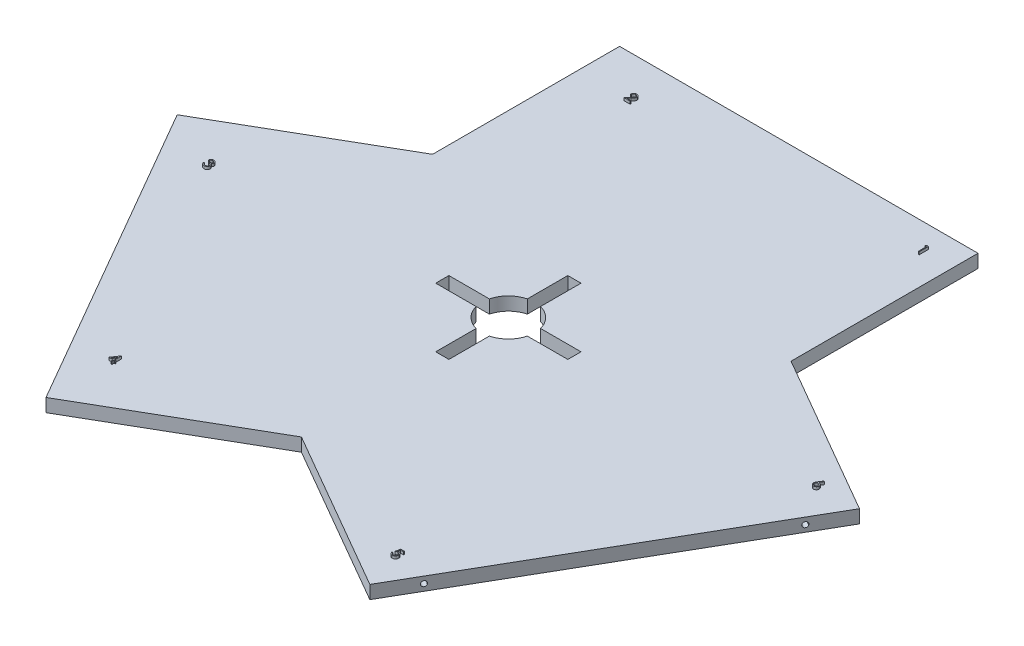
from build123d import *

# Parameters (mm, degrees)
BOSS_EXTRUDE1_DEPTH = 5
BOSS_EXTRUDE2_DEPTH = 1
SKETCH3_R           = 1
CUT_EXTRUDE1_DEPTH  = 10
CIRPATTERN1_COUNT   = 3


with BuildPart() as part:
    # Sketch1 → Boss-Extrude1 (new body)
    with BuildSketch(Plane(origin=(0, 0, 0), x_dir=(1, 0, 0), z_dir=(0, 1, 0))):
        Polygon((-67.827282718, 39.160099935), (-67.827282718, 109.92847338), (67.827282718, 109.92847338), (67.827282718, 39.160099935), (129.114491905, 3.775913213), (61.287209187, -113.704386593), (0, -78.320199871), (-61.287209187, -113.704386593), (-129.114491905, 3.775913213), align=None)
        with BuildLine():
            ThreePointArc((9.682458366, 2.5), (7.071067812, 7.071067812), (2.5, 9.682458366))
            Line((2.5, 9.682458366), (2.5, 25))
            Line((2.5, 25), (-2.5, 25))
            Line((-2.5, 25), (-2.5, 9.682458366))
            ThreePointArc((-2.5, 9.682458366), (-7.071067812, 7.071067812), (-9.682458366, 2.5))
            Line((-9.682458366, 2.5), (-25, 2.5))
            Line((-25, 2.5), (-25, -2.5))
            Line((-25, -2.5), (-9.682458366, -2.5))
            ThreePointArc((-9.682458366, -2.5), (-7.071067812, -7.071067812), (-2.5, -9.682458366))
            Line((-2.5, -9.682458366), (-2.5, -25))
            Line((-2.5, -25), (2.5, -25))
            Line((2.5, -25), (2.5, -9.682458366))
            ThreePointArc((2.5, -9.682458366), (7.071067812, -7.071067812), (9.682458366, -2.5))
            Line((9.682458366, -2.5), (25, -2.5))
            Line((25, -2.5), (25, 2.5))
            Line((25, 2.5), (9.682458366, 2.5))
        make_face(mode=Mode.SUBTRACT)
    extrude(amount=BOSS_EXTRUDE1_DEPTH)

    # Sketch2 → Boss-Extrude2 (add)
    # profile 1 of 6: a face of its own
    with BuildSketch(Plane(origin=(0, 5, 0), x_dir=(1, 0, 0), z_dir=(0, 1, 0))):
        Polygon((56.557223015, 101.794048137), (57.204358432, 101.794048137), (57.204358432, 98.294048137), (56.890255868, 98.294048137), (56.890255868, 101.435073778), (56.351794329, 101.435073778), align=None)
    # profile 2 of 6: a face of its own
    with BuildSketch(Plane(origin=(0, 5, 0), x_dir=(1, 0, 0), z_dir=(0, 1, 0))):
        with BuildLine():
            Line((-48.778901469, 95.373471968), (-49.093004033, 95.373471968))
            add(Edge.make_bspline(
                [(-49.093004033, 95.373471968), (-49.09095688, 95.415142856), (-49.086936326, 95.49698337), (-49.068108037, 95.616307276), (-49.04116716, 95.730362075), (-49.003075706, 95.838231989), (-48.955769428, 95.940870796), (-48.899039401, 96.037870812), (-48.83184555, 96.128862001), (-48.755638816, 96.213000844), (-48.672870177, 96.290188415), (-48.583564238, 96.356843658), (-48.48971921, 96.413161329), (-48.391619811, 96.460242571), (-48.288159248, 96.495582417), (-48.18027639, 96.521804056), (-48.067497254, 96.537580402), (-47.990657232, 96.539276188), (-47.951577751, 96.540138634)],
                knots=[0, 0, 0, 0, 1.10065271, 2.161652631, 3.183658789, 4.190468796, 5.17591951, 6.163126047, 7.15150782, 8.156236427, 9.156009102, 10.134482811, 11.092018607, 12.041330605, 13.001268258, 13.972401359, 14.968799086, 16, 16, 16, 16], degree=3))
            add(Edge.make_bspline(
                [(-47.951577751, 96.540138634), (-47.913199677, 96.539240178), (-47.837788133, 96.537474743), (-47.727726118, 96.522313714), (-47.622948824, 96.498568122), (-47.523661057, 96.465252706), (-47.430654993, 96.420468279), (-47.343231948, 96.36667074), (-47.260351137, 96.304450909), (-47.185744354, 96.231197095), (-47.117236274, 96.152994711), (-47.058134019, 96.069506807), (-47.007520856, 95.983277521), (-46.965333176, 95.89364932), (-46.934277037, 95.799778291), (-46.910698829, 95.703031088), (-46.897371415, 95.602406277), (-46.895325992, 95.534299722), (-46.894286085, 95.499673891)],
                knots=[0, 0, 0, 0, 1.111607364, 2.184268762, 3.212621178, 4.221274766, 5.211760367, 6.196651075, 7.1921475, 8.207485113, 9.220403448, 10.201281604, 11.166441695, 12.114753415, 13.065576456, 14.026450734, 14.996634279, 16, 16, 16, 16], degree=3))
            add(Edge.make_bspline(
                [(-46.894286085, 95.499673891), (-46.895979348, 95.450926056), (-46.899336159, 95.354285843), (-46.928050535, 95.21227098), (-46.972897047, 95.074677561), (-47.026894403, 94.963940259), (-47.081366847, 94.874706765), (-47.130454355, 94.80123806), (-47.187919166, 94.722132592), (-47.254597664, 94.637655254), (-47.329110536, 94.547144349), (-47.4121327, 94.450654554), (-47.504256182, 94.349182784), (-47.568914682, 94.279877183), (-47.602419098, 94.243964756)],
                knots=[0, 0, 0, 0, 1.184426356, 2.348067706, 3.509069118, 4.696110526, 5.333549288, 6.050745305, 6.844228056, 7.710549037, 8.667450064, 9.695053472, 10.805634456, 12, 12, 12, 12], degree=3))
            Line((-47.602419098, 94.243964756), (-48.478120219, 93.309369404))
            Line((-48.478120219, 93.309369404), (-46.84941429, 93.309369404))
            Line((-46.84941429, 93.309369404), (-46.84941429, 92.950395045))
            Line((-46.84941429, 92.950395045), (-49.227619418, 92.950395045))
            Line((-49.227619418, 92.950395045), (-47.870247623, 94.398912673))
            add(Edge.make_bspline(
                [(-47.870247623, 94.398912673), (-47.837199736, 94.433410979), (-47.773721509, 94.499675166), (-47.683938932, 94.596418126), (-47.603299944, 94.686167667), (-47.531282551, 94.768754215), (-47.469449046, 94.845385783), (-47.414576814, 94.913580487), (-47.370611223, 94.976334937), (-47.322895827, 95.049075551), (-47.276681846, 95.137887868), (-47.23696949, 95.246421557), (-47.212754641, 95.35814881), (-47.209849806, 95.433650847), (-47.208388649, 95.471629019)],
                knots=[0, 0, 0, 0, 1.329631726, 2.553950428, 3.673215718, 4.687767853, 5.603093632, 6.413772471, 7.123043292, 7.734684054, 8.834405432, 9.900288307, 10.943827018, 12, 12, 12, 12], degree=3))
            add(Edge.make_bspline(
                [(-47.208388649, 95.471629019), (-47.209024391, 95.495510417), (-47.210277317, 95.542576068), (-47.221335015, 95.611581827), (-47.238045521, 95.678146641), (-47.261990779, 95.74247526), (-47.293597519, 95.803920912), (-47.332070899, 95.862558392), (-47.376460962, 95.919247357), (-47.427812231, 95.972400655), (-47.484223751, 96.021081861), (-47.543818001, 96.064205946), (-47.606868105, 96.100245057), (-47.673108227, 96.129788554), (-47.742353697, 96.152963935), (-47.814738442, 96.169022515), (-47.890062458, 96.179104999), (-47.941495954, 96.180469171), (-47.967703553, 96.181164275)],
                knots=[0, 0, 0, 0, 0.991446411, 1.95395049, 2.89581595, 3.838931463, 4.798493298, 5.75982156, 6.748411868, 7.785213223, 8.824556874, 9.840280684, 10.836137867, 11.835679398, 12.848801643, 13.863922112, 14.911575587, 16, 16, 16, 16], degree=3))
            add(Edge.make_bspline(
                [(-47.967703553, 96.181164275), (-47.995074385, 96.180449243), (-48.048826182, 96.179045038), (-48.127745215, 96.169222374), (-48.203030992, 96.152276533), (-48.274872895, 96.129099859), (-48.343392481, 96.09964131), (-48.408256525, 96.062949566), (-48.469319414, 96.019166072), (-48.526695937, 95.969525516), (-48.579559917, 95.914257915), (-48.626006792, 95.852647952), (-48.666590807, 95.785820536), (-48.70200004, 95.713955986), (-48.73075573, 95.636402206), (-48.752728881, 95.553434501), (-48.770115727, 95.46541312), (-48.775924248, 95.404628035), (-48.778901469, 95.373471968)],
                knots=[0, 0, 0, 0, 1.031018746, 2.02475058, 2.990194455, 3.934040569, 4.864654155, 5.795059489, 6.735614925, 7.690564532, 8.649604399, 9.611025574, 10.590972636, 11.591080095, 12.624614302, 13.701020113, 14.821632451, 16, 16, 16, 16], degree=3))
        make_face()
    # profile 3 of 6: a face of its own
    with BuildSketch(Plane(origin=(0, 5, 0), x_dir=(1, 0, 0), z_dir=(0, 1, 0))):
        with BuildLine():
            Line((-107.058413792, -6.0662583), (-107.372516356, -6.0662583))
            add(Edge.make_bspline(
                [(-107.372516356, -6.0662583), (-107.364006805, -6.031025816), (-107.34737133, -5.962149192), (-107.312673756, -5.863741931), (-107.274874501, -5.77061841), (-107.229485397, -5.684522336), (-107.179976642, -5.603723433), (-107.123253921, -5.530054309), (-107.061934198, -5.461641343), (-106.994109249, -5.400928106), (-106.922980587, -5.345950377), (-106.847545968, -5.299075319), (-106.769323074, -5.258751166), (-106.687769941, -5.225530934), (-106.602643769, -5.200505411), (-106.514714146, -5.182348605), (-106.423750646, -5.170557491), (-106.362003055, -5.169406728), (-106.330649369, -5.168822403)],
                knots=[0, 0, 0, 0, 1.162005537, 2.271625781, 3.343758855, 4.383309926, 5.390229558, 6.379919256, 7.361854164, 8.333198761, 9.295911338, 10.242430842, 11.177959212, 12.116337295, 13.062827104, 14.020064771, 14.994644689, 16, 16, 16, 16], degree=3))
            add(Edge.make_bspline(
                [(-106.330649369, -5.168822403), (-106.284966627, -5.170201633), (-106.194597616, -5.172930009), (-106.061834569, -5.197844445), (-105.93380775, -5.237269577), (-105.811918502, -5.291743305), (-105.698700069, -5.358930618), (-105.597963883, -5.438895355), (-105.511075372, -5.530094656), (-105.438180994, -5.63082722), (-105.381105995, -5.73848273), (-105.339019622, -5.849282887), (-105.313397941, -5.962964858), (-105.310077384, -6.039722137), (-105.308413792, -6.078177371)],
                knots=[0, 0, 0, 0, 1.083050992, 2.142477498, 3.193116406, 4.255571735, 5.30263384, 6.308962982, 7.297363603, 8.282367274, 9.249857812, 10.179914175, 11.08814088, 12, 12, 12, 12], degree=3))
            add(Edge.make_bspline(
                [(-105.308413792, -6.078177371), (-105.309577383, -6.115184165), (-105.31185435, -6.18760072), (-105.331188056, -6.293322217), (-105.363724319, -6.392963817), (-105.408794081, -6.486944979), (-105.467135631, -6.574669819), (-105.537808328, -6.65633571), (-105.62131099, -6.732304868), (-105.684589928, -6.775824341), (-105.717167798, -6.798229454)],
                knots=[0, 0, 0, 0, 1.024540389, 2.004866551, 2.965041327, 3.920577974, 4.882998113, 5.874504559, 6.905732034, 8, 8, 8, 8], degree=3))
            add(Edge.make_bspline(
                [(-105.717167798, -6.798229454), (-105.679936044, -6.816207626), (-105.60616917, -6.851827583), (-105.50561864, -6.921683341), (-105.414340765, -7.002339688), (-105.363437046, -7.065282341), (-105.337860907, -7.096907339)],
                knots=[0, 0, 0, 0, 1.015518401, 2.012035669, 3.001164323, 4, 4, 4, 4], degree=3))
            add(Edge.make_bspline(
                [(-105.337860907, -7.096907339), (-105.321019565, -7.11996509), (-105.287612669, -7.165703007), (-105.246377135, -7.239239433), (-105.208968021, -7.313590922), (-105.179817802, -7.390750328), (-105.157243935, -7.469823342), (-105.141107903, -7.550945738), (-105.131083762, -7.63418376), (-105.12964821, -7.690496241), (-105.128926613, -7.718802371)],
                knots=[0, 0, 0, 0, 1.025084078, 2.033381695, 3.024893161, 4.013698104, 4.991890475, 5.976764909, 6.982997093, 8, 8, 8, 8], degree=3))
            add(Edge.make_bspline(
                [(-105.128926613, -7.718802371), (-105.130721126, -7.767812092), (-105.134301708, -7.865600894), (-105.166305782, -8.010075615), (-105.215919023, -8.151301118), (-105.286375959, -8.286375957), (-105.372243468, -8.412756338), (-105.474400792, -8.525832647), (-105.5916872, -8.623031251), (-105.722492849, -8.704241479), (-105.864209978, -8.769159402), (-106.01578557, -8.814216844), (-106.175035624, -8.843562844), (-106.284242921, -8.846709713), (-106.339763952, -8.848309582)],
                knots=[0, 0, 0, 0, 0.955779014, 1.907060117, 2.875433937, 3.871313158, 4.872415639, 5.851225146, 6.836215519, 7.83643374, 8.849228613, 9.86973379, 10.916971861, 12, 12, 12, 12], degree=3))
            add(Edge.make_bspline(
                [(-106.339763952, -8.848309582), (-106.377183253, -8.847441369), (-106.450811958, -8.845733015), (-106.559055456, -8.834054414), (-106.662377155, -8.812724408), (-106.760916753, -8.784021103), (-106.85476179, -8.747629361), (-106.943625895, -8.702310663), (-107.028055788, -8.648999161), (-107.107254739, -8.587065573), (-107.181213307, -8.517784233), (-107.247966031, -8.439925223), (-107.308625824, -8.354927819), (-107.361568463, -8.261804763), (-107.409205416, -8.161759506), (-107.448386372, -8.053511008), (-107.482871941, -7.938026986), (-107.498905405, -7.857549245), (-107.507131741, -7.8162583)],
                knots=[0, 0, 0, 0, 1.048658725, 2.063410685, 3.046034179, 4.001477787, 4.936774919, 5.862367409, 6.792675028, 7.730719943, 8.675894397, 9.627829632, 10.600096036, 11.597688215, 12.626045268, 13.701542398, 14.82072376, 16, 16, 16, 16], degree=3))
            Line((-107.507131741, -7.8162583), (-107.193029177, -7.8162583))
            add(Edge.make_bspline(
                [(-107.193029177, -7.8162583), (-107.184845885, -7.843207314), (-107.168928673, -7.895625485), (-107.141834375, -7.971065791), (-107.110966102, -8.040223844), (-107.077851544, -8.103606966), (-107.043073098, -8.161839369), (-107.004158173, -8.213381238), (-106.963989027, -8.26049644), (-106.933709674, -8.287041052), (-106.918890555, -8.300032339)],
                knots=[0, 0, 0, 0, 1.198163088, 2.33053128, 3.407730985, 4.417276592, 5.372219308, 6.28897303, 7.162600585, 8, 8, 8, 8], degree=3))
            add(Edge.make_bspline(
                [(-106.918890555, -8.300032339), (-106.899293978, -8.315140673), (-106.860161315, -8.345310704), (-106.796393084, -8.383812333), (-106.729328198, -8.417173358), (-106.657513524, -8.442657054), (-106.582498754, -8.464234715), (-106.503071388, -8.478355234), (-106.419932171, -8.488043405), (-106.363164408, -8.488898337), (-106.334154978, -8.489335223)],
                knots=[0, 0, 0, 0, 0.946170439, 1.889420265, 2.845303464, 3.807233317, 4.801018734, 5.828864929, 6.890507805, 8, 8, 8, 8], degree=3))
            add(Edge.make_bspline(
                [(-106.334154978, -8.489335223), (-106.301401475, -8.488719318), (-106.237354828, -8.487514969), (-106.143899969, -8.476439262), (-106.054992521, -8.460308848), (-105.971619596, -8.435395865), (-105.892689088, -8.404615014), (-105.819307439, -8.365966609), (-105.750511333, -8.320621887), (-105.687181927, -8.269082728), (-105.63023642, -8.212661233), (-105.580096906, -8.153648162), (-105.537472245, -8.092292333), (-105.503088667, -8.028254212), (-105.475938116, -7.961798983), (-105.457454916, -7.892740153), (-105.444603401, -7.821642887), (-105.443556788, -7.773313918), (-105.443029177, -7.748950608)],
                knots=[0, 0, 0, 0, 1.217147791, 2.380027433, 3.494444702, 4.572153297, 5.609568379, 6.639424714, 7.649109417, 8.668170816, 9.669597737, 10.625200337, 11.543417969, 12.441394052, 13.322311151, 14.205496177, 15.095365482, 16, 16, 16, 16], degree=3))
            add(Edge.make_bspline(
                [(-105.443029177, -7.748950608), (-105.444559478, -7.716339269), (-105.447612467, -7.651278861), (-105.470921046, -7.555561287), (-105.50925991, -7.463337874), (-105.562932422, -7.376182084), (-105.62826815, -7.295406183), (-105.704633057, -7.2233347), (-105.792661285, -7.163864609), (-105.873681155, -7.122775953), (-105.945446311, -7.094738877), (-106.006861695, -7.076063913), (-106.075618299, -7.060250257), (-106.150884648, -7.045537986), (-106.233227864, -7.033016638), (-106.322558302, -7.022574822), (-106.418894064, -7.014219781), (-106.48558523, -7.010488686), (-106.519952254, -7.008565993)],
                knots=[0, 0, 0, 0, 1.07054697, 2.135767047, 3.216561865, 4.33974944, 5.486079747, 6.621378074, 7.775625952, 8.963672916, 9.598146892, 10.304877434, 11.070270905, 11.915000392, 12.823868403, 13.805723172, 14.86925407, 16, 16, 16, 16], degree=3))
            Line((-106.519952254, -7.008565993), (-106.519952254, -6.649591634))
            add(Edge.make_bspline(
                [(-106.519952254, -6.649591634), (-106.476651088, -6.64885683), (-106.391834741, -6.64741753), (-106.267940437, -6.63000952), (-106.149467124, -6.605928891), (-106.039040382, -6.569043699), (-105.938391669, -6.526203402), (-105.851072067, -6.476351193), (-105.77830492, -6.420936444), (-105.720443848, -6.359103834), (-105.67691462, -6.292788787), (-105.645087822, -6.223672129), (-105.626287496, -6.151148068), (-105.623777829, -6.1016534), (-105.622516356, -6.076775127)],
                knots=[0, 0, 0, 0, 1.321986639, 2.589447074, 3.816329219, 5.01088745, 6.139805852, 7.153945165, 8.075214402, 8.924034688, 9.728124013, 10.488707548, 11.240355623, 12, 12, 12, 12], degree=3))
            add(Edge.make_bspline(
                [(-105.622516356, -6.076775127), (-105.622930767, -6.058497382), (-105.623755218, -6.022134675), (-105.634152496, -5.969009606), (-105.649776537, -5.91750866), (-105.671256266, -5.86785085), (-105.700006465, -5.820380576), (-105.734412451, -5.774693127), (-105.775380552, -5.731049348), (-105.822325999, -5.690369029), (-105.872737804, -5.651599792), (-105.927987579, -5.618686155), (-105.986409453, -5.590541092), (-106.048068108, -5.56733159), (-106.113163639, -5.549872302), (-106.181390196, -5.537336461), (-106.25287788, -5.529498806), (-106.301649612, -5.52837039), (-106.326442638, -5.527796762)],
                knots=[0, 0, 0, 0, 0.884392785, 1.759457502, 2.611959086, 3.489218968, 4.37281399, 5.2945488, 6.255912374, 7.266815255, 8.301784654, 9.332968512, 10.37626691, 11.440494194, 12.520033166, 13.637162961, 14.798855837, 16, 16, 16, 16], degree=3))
            add(Edge.make_bspline(
                [(-106.326442638, -5.527796762), (-106.366294306, -5.529188124), (-106.444133883, -5.531905777), (-106.556348799, -5.555708791), (-106.660668133, -5.593686874), (-106.7404068, -5.639019894), (-106.799289374, -5.683770328), (-106.841366312, -5.722852714), (-106.882686823, -5.766285538), (-106.9205325, -5.816743913), (-106.958806476, -5.870810703), (-106.993651038, -5.931234385), (-107.02751073, -5.996438779), (-107.04791328, -6.042534414), (-107.058413792, -6.0662583)],
                knots=[0, 0, 0, 0, 1.472543308, 2.876219568, 4.221790263, 5.565193594, 6.249813518, 6.953379497, 7.687249741, 8.463570142, 9.283606569, 10.136032583, 11.040678096, 12, 12, 12, 12], degree=3))
        make_face()
    # profile 4 of 6: a face of its own
    with BuildSketch(Plane(origin=(0, 5, 0), x_dir=(1, 0, 0), z_dir=(0, 1, 0))):
        Polygon((-59.67302658, -86.858292456), (-59.609224497, -86.858292456), (-59.609224497, -89.281369379), (-59.205378343, -89.281369379), (-59.205378343, -89.640343738), (-59.609224497, -89.640343738), (-59.609224497, -90.448036046), (-59.923327061, -90.448036046), (-59.923327061, -89.640343738), (-61.583583471, -89.640343738), align=None)
        Polygon((-59.923327061, -89.281369379), (-59.923327061, -87.761337328), (-60.966596292, -89.281369379), align=None, mode=Mode.SUBTRACT)
    # profile 5 of 6: a face of its own
    with BuildSketch(Plane(origin=(0, 5, 0), x_dir=(1, 0, 0), z_dir=(0, 1, 0))):
        with BuildLine():
            Line((58.012050739, -97.291610226), (58.012050739, -97.650584585))
            Line((58.012050739, -97.650584585), (56.821545932, -97.650584585))
            Line((56.821545932, -97.650584585), (56.632944169, -98.571157501))
            add(Edge.make_bspline(
                [(56.632944169, -98.571157501), (56.670000043, -98.56092723), (56.741789939, -98.541107696), (56.8477498, -98.519101926), (56.948342003, -98.505836481), (57.013617374, -98.504025171), (57.045203784, -98.503148687)],
                knots=[0, 0, 0, 0, 1.100273476, 2.13160584, 3.095893838, 4, 4, 4, 4], degree=3))
            add(Edge.make_bspline(
                [(57.045203784, -98.503148687), (57.084287524, -98.503994623), (57.161135921, -98.505657944), (57.273574868, -98.521629793), (57.380907761, -98.546769708), (57.482910132, -98.58189023), (57.579770682, -98.626799963), (57.670598244, -98.682899903), (57.756756157, -98.748433234), (57.836698751, -98.823778246), (57.909223059, -98.906699863), (57.972989049, -98.995857734), (58.027151639, -99.090385396), (58.070712394, -99.191186005), (58.105496728, -99.297145158), (58.128648723, -99.409377741), (58.144065432, -99.526825861), (58.145787818, -99.607130431), (58.146666124, -99.648080578)],
                knots=[0, 0, 0, 0, 1.052922333, 2.070308379, 3.05430497, 4.020497103, 4.973039431, 5.925935799, 6.892292201, 7.88610001, 8.88166317, 9.857072816, 10.836096531, 11.812156883, 12.81219415, 13.836441305, 14.89672472, 16, 16, 16, 16], degree=3))
            add(Edge.make_bspline(
                [(58.146666124, -99.648080578), (58.146001049, -99.676602799), (58.144679886, -99.733261786), (58.137961298, -99.817405987), (58.125025582, -99.89976882), (58.107657858, -99.980361212), (58.08511544, -100.059030584), (58.057826386, -100.136002112), (58.024430359, -100.210796719), (57.987798984, -100.284122114), (57.946552506, -100.354320621), (57.900773998, -100.419969607), (57.852408507, -100.482053889), (57.800367122, -100.539907622), (57.744166126, -100.59315064), (57.68448616, -100.642098921), (57.621803441, -100.687580252), (57.555148198, -100.727748447), (57.486005715, -100.764711403), (57.413377498, -100.79503494), (57.338916798, -100.822145468), (57.261551922, -100.843754996), (57.181458109, -100.860687551), (57.098503334, -100.872188151), (57.013122664, -100.880564589), (56.955247651, -100.881088946), (56.926013079, -100.881353816)],
                knots=[0, 0, 0, 0, 1.056347294, 2.098418968, 3.122841568, 4.141288669, 5.149314143, 6.15115421, 7.162517403, 8.180376062, 9.185164535, 10.17417709, 11.141909838, 12.097768115, 13.052685741, 14.0056014, 14.954263652, 15.917497458, 16.885230207, 17.854509472, 18.828990115, 19.81800267, 20.826176721, 21.857883937, 22.917946725, 24, 24, 24, 24], degree=3))
            add(Edge.make_bspline(
                [(56.926013079, -100.881353816), (56.891138898, -100.880662978), (56.822528068, -100.879303835), (56.722007501, -100.86508535), (56.625292895, -100.844721434), (56.533162794, -100.814085164), (56.44479153, -100.775697869), (56.361368812, -100.727181698), (56.280763036, -100.672202594), (56.206250999, -100.607322241), (56.137094886, -100.536406559), (56.075188377, -100.459448918), (56.0200548, -100.377719476), (55.972577053, -100.290821322), (55.932079032, -100.198982791), (55.900264044, -100.10185979), (55.874585689, -99.999959786), (55.863722268, -99.929806275), (55.858204585, -99.894174328)],
                knots=[0, 0, 0, 0, 1.0467383, 2.05933395, 3.04377827, 4.011590433, 4.970194871, 5.932262533, 6.905835911, 7.896367577, 8.894135286, 9.877477877, 10.858688626, 11.851381753, 12.8477658, 13.868841284, 14.917554742, 16, 16, 16, 16], degree=3))
            Line((55.858204585, -99.894174328), (56.17230715, -99.894174328))
            add(Edge.make_bspline(
                [(56.17230715, -99.894174328), (56.180035707, -99.927550781), (56.194890423, -99.991702176), (56.227496172, -100.081833517), (56.267362048, -100.162152741), (56.314766396, -100.233722324), (56.371316427, -100.296131321), (56.435845855, -100.351748383), (56.508193579, -100.401923512), (56.588586808, -100.44374628), (56.673399888, -100.479415033), (56.762167098, -100.503166728), (56.852471444, -100.519867621), (56.913549814, -100.521539382), (56.944242246, -100.522379457)],
                knots=[0, 0, 0, 0, 1.136247022, 2.183929868, 3.172523383, 4.106158343, 5.02341133, 5.958108904, 6.928429099, 7.938127109, 8.96079061, 9.975095812, 10.982467395, 12, 12, 12, 12], degree=3))
            add(Edge.make_bspline(
                [(56.944242246, -100.522379457), (56.97420069, -100.521558679), (57.033189112, -100.51994256), (57.120000499, -100.507503548), (57.203813373, -100.488345977), (57.28380073, -100.459676122), (57.36136227, -100.424831403), (57.43453604, -100.380116328), (57.505438917, -100.328656309), (57.571867051, -100.269699679), (57.6327065, -100.204729984), (57.686462621, -100.135252591), (57.731239534, -100.061135745), (57.768973643, -99.983662592), (57.797626942, -99.901984034), (57.818067923, -99.816482859), (57.830070982, -99.726947879), (57.831722162, -99.665878569), (57.83256356, -99.634759264)],
                knots=[0, 0, 0, 0, 1.027316725, 2.022795036, 3.002884548, 3.971462791, 4.93288096, 5.914575861, 6.907176829, 7.935150275, 8.956128384, 9.956726525, 10.942570165, 11.921478529, 12.907843606, 13.90538589, 14.932640048, 16, 16, 16, 16], degree=3))
            add(Edge.make_bspline(
                [(57.83256356, -99.634759264), (57.83190508, -99.606683513), (57.830616201, -99.551729224), (57.82008563, -99.471330017), (57.801768658, -99.395256975), (57.776344778, -99.323142741), (57.74406527, -99.254919298), (57.704618958, -99.190516238), (57.65726556, -99.130782405), (57.603173671, -99.075689851), (57.54391563, -99.024844977), (57.478471888, -98.98150089), (57.408211961, -98.945036972), (57.333982362, -98.913568974), (57.254017463, -98.890968229), (57.169900831, -98.874000343), (57.080724123, -98.864184981), (57.019753434, -98.862823092), (56.988412919, -98.862123046)],
                knots=[0, 0, 0, 0, 1.045622112, 2.046656509, 3.013763289, 3.955457236, 4.890082067, 5.820317437, 6.762574623, 7.722996705, 8.69280354, 9.665887285, 10.63943826, 11.638615906, 12.663482002, 13.728887084, 14.832589034, 16, 16, 16, 16], degree=3))
            add(Edge.make_bspline(
                [(56.988412919, -98.862123046), (56.96128399, -98.862703637), (56.905269635, -98.863902411), (56.819346808, -98.872728908), (56.729055085, -98.886968202), (56.634740589, -98.90655445), (56.536120081, -98.932185526), (56.433401681, -98.962900027), (56.326369414, -98.999622026), (56.25425169, -99.027354239), (56.217178944, -99.041610226)],
                knots=[0, 0, 0, 0, 0.817624296, 1.688186739, 2.600797293, 3.572016777, 4.590301741, 5.671205678, 6.80286297, 8, 8, 8, 8], degree=3))
            Line((56.217178944, -99.041610226), (56.576153303, -97.291610226))
            Line((56.576153303, -97.291610226), (58.012050739, -97.291610226))
        make_face()
    # profile 6 of 6: a face of its own
    with BuildSketch(Plane(origin=(0, 5, 0), x_dir=(1, 0, 0), z_dir=(0, 1, 0))):
        with BuildLine():
            Line((114.364124303, 5.15641952), (114.606011322, 4.966415514))
            Line((114.606011322, 4.966415514), (113.681231675, 3.552252854))
            add(Edge.make_bspline(
                [(113.681231675, 3.552252854), (113.742801951, 3.562066714), (113.862901738, 3.581209759), (113.984467637, 3.584367704), (114.043711642, 3.5859067)],
                knots=[0, 0, 0, 0, 1.025318673, 2, 2, 2, 2], degree=3))
            add(Edge.make_bspline(
                [(114.043711642, 3.5859067), (114.079284139, 3.584950588), (114.149307539, 3.583068511), (114.252114341, 3.56858466), (114.350903277, 3.545759548), (114.44526489, 3.512487292), (114.535537872, 3.469984938), (114.622240268, 3.419046067), (114.703742278, 3.357040387), (114.781093457, 3.287775431), (114.851320554, 3.211058447), (114.91349661, 3.12965711), (114.965723402, 3.043656229), (115.008097323, 2.953099363), (115.041002202, 2.858126104), (115.064989847, 2.758857964), (115.07916944, 2.655226493), (115.08109493, 2.584748317), (115.082073021, 2.548947565)],
                knots=[0, 0, 0, 0, 1.04369286, 2.054478336, 3.041073146, 4.015093852, 4.984733326, 5.965804835, 6.960378782, 7.985147595, 9.009457201, 10.008161701, 10.986880575, 11.956520048, 12.937015923, 13.931873656, 14.949455224, 16, 16, 16, 16], degree=3))
            add(Edge.make_bspline(
                [(115.082073021, 2.548947565), (115.080649916, 2.499967861), (115.077849582, 2.403587395), (115.049945786, 2.263210689), (115.006586141, 2.129478173), (114.944608613, 2.004525002), (114.86762623, 1.888522432), (114.773748637, 1.785736967), (114.666305149, 1.69406693), (114.544818351, 1.61741031), (114.414075387, 1.554807259), (114.276723389, 1.509842017), (114.134096243, 1.482158548), (114.037291635, 1.478687945), (113.988323021, 1.476932341)],
                knots=[0, 0, 0, 0, 1.031375318, 2.029502543, 3.004789286, 3.987476834, 4.960371455, 5.9300674, 6.912260825, 7.929083631, 8.949397511, 9.960523116, 10.96833055, 12, 12, 12, 12], degree=3))
            add(Edge.make_bspline(
                [(113.988323021, 1.476932341), (113.94122632, 1.478460546), (113.847936002, 1.481487654), (113.710703208, 1.508453592), (113.57884019, 1.552160695), (113.45327081, 1.612374974), (113.336950197, 1.688432857), (113.23288456, 1.779995136), (113.141592786, 1.885104601), (113.065618165, 2.003744948), (113.005359433, 2.131234906), (112.960169508, 2.264172062), (112.933773264, 2.402072044), (112.930084708, 2.495553183), (112.928226867, 2.542637469)],
                knots=[0, 0, 0, 0, 1.012016664, 2.004627821, 2.994792927, 3.992885782, 4.990978636, 5.973936114, 6.964471063, 7.975201453, 8.993600317, 9.990122807, 10.98767138, 12, 12, 12, 12], degree=3))
            add(Edge.make_bspline(
                [(112.928226867, 2.542637469), (112.929408312, 2.578682052), (112.931820597, 2.652278204), (112.948663987, 2.763742232), (112.975728782, 2.877793314), (113.006039028, 2.974547507), (113.038064638, 3.053809029), (113.064717178, 3.11771252), (113.097891174, 3.183473593), (113.133264555, 3.253347229), (113.174021424, 3.325532662), (113.218337073, 3.401236331), (113.267436724, 3.479254259), (113.301856887, 3.532198454), (113.319452828, 3.559264071)],
                knots=[0, 0, 0, 0, 1.173818275, 2.396712641, 3.66331629, 4.989737886, 5.693666774, 6.447286557, 7.243889047, 8.091586357, 8.998013824, 9.943181721, 10.948533338, 12, 12, 12, 12], degree=3))
            Line((113.319452828, 3.559264071), (114.364124303, 5.15641952))
        make_face()
        with BuildLine():
            add(Edge.make_bspline(
                [(113.977806194, 3.226932341), (113.951143949, 3.226154297), (113.89906484, 3.224634552), (113.822657425, 3.2158093), (113.750344173, 3.199190234), (113.68116704, 3.178023902), (113.616419337, 3.148920843), (113.555630497, 3.113569044), (113.498565445, 3.071947865), (113.445821893, 3.024646954), (113.39800223, 2.972858921), (113.356821099, 2.917389399), (113.321298699, 2.859575196), (113.29241688, 2.798933254), (113.269926804, 2.735486754), (113.253658554, 2.669527505), (113.244604802, 2.600613199), (113.243098571, 2.553880696), (113.242329431, 2.530017277)],
                knots=[0, 0, 0, 0, 1.129588631, 2.206414736, 3.251139165, 4.268635594, 5.265702196, 6.250456724, 7.242448911, 8.251968645, 9.246821453, 10.222880186, 11.173611482, 12.116736599, 13.062300278, 14.020270554, 14.989073742, 16, 16, 16, 16], degree=3))
            add(Edge.make_bspline(
                [(113.242329431, 2.530017277), (113.242955792, 2.506367297), (113.244183994, 2.459993207), (113.255336314, 2.391654027), (113.272371396, 2.325889119), (113.297711792, 2.26303752), (113.32793868, 2.202141202), (113.367844004, 2.145405917), (113.41206079, 2.089385847), (113.464914724, 2.038384375), (113.521638087, 1.990927751), (113.582239289, 1.949447497), (113.645399249, 1.913961324), (113.711970671, 1.886150226), (113.781009055, 1.86332594), (113.853089609, 1.84726446), (113.928262465, 1.838183934), (113.979184403, 1.836675741), (114.005149944, 1.8359067)],
                knots=[0, 0, 0, 0, 0.989467248, 1.94019797, 2.891935182, 3.827694429, 4.772920941, 5.730924762, 6.725747692, 7.756678648, 8.79901574, 9.819492441, 10.826891316, 11.826466727, 12.835195252, 13.867842842, 14.912794438, 16, 16, 16, 16], degree=3))
            add(Edge.make_bspline(
                [(114.005149944, 1.8359067), (114.031115442, 1.836675801), (114.082037297, 1.838184113), (114.157210757, 1.847263782), (114.229289076, 1.86332843), (114.298335584, 1.8861412), (114.364877015, 1.91399481), (114.427981737, 1.949226729), (114.48800983, 1.991182847), (114.54477043, 2.038303275), (114.597404368, 2.089676127), (114.642681647, 2.14490585), (114.68136488, 2.202599745), (114.712799068, 2.262797635), (114.737860359, 2.325927122), (114.754981826, 2.391643846), (114.766111115, 2.459995872), (114.767342481, 2.506368197), (114.767970457, 2.530017277)],
                knots=[0, 0, 0, 0, 1.087397944, 2.132534446, 3.165364764, 4.174271784, 5.174024072, 6.181601208, 7.194203697, 8.236725232, 9.267838612, 10.269026844, 11.221737037, 12.171628256, 13.107553087, 14.05945871, 15.010357665, 16, 16, 16, 16], degree=3))
            add(Edge.make_bspline(
                [(114.767970457, 2.530017277), (114.767420164, 2.553911828), (114.766340117, 2.60080906), (114.754124169, 2.669496678), (114.737181795, 2.735821884), (114.711598764, 2.799367834), (114.678362219, 2.859883761), (114.637878812, 2.917675362), (114.591046242, 2.973185709), (114.536948703, 3.024748517), (114.478058469, 3.071895595), (114.415442883, 3.113515152), (114.34993491, 3.148640128), (114.281600967, 3.177947231), (114.209658084, 3.199096705), (114.135267745, 3.215749948), (114.057478503, 3.224611966), (114.004701894, 3.226149031), (113.977806194, 3.226932341)],
                knots=[0, 0, 0, 0, 0.978206639, 1.919901502, 2.851605144, 3.780102724, 4.718870031, 5.675451981, 6.667674623, 7.690630536, 8.733308323, 9.756129687, 10.767539656, 11.776269907, 12.797430371, 13.836405707, 14.897401972, 16, 16, 16, 16], degree=3))
        make_face(mode=Mode.SUBTRACT)
    extrude(amount=BOSS_EXTRUDE2_DEPTH)

    # Sketch3 → Cut-Extrude1 (cut)
    with BuildSketch(Plane(origin=(0, 0, -109.92847338), x_dir=(-1, 0, 0), z_dir=(0, 0, -1))):
        with Locations((-52.827282718, 2.5)):
            Circle(SKETCH3_R)
        with Locations(Location((52.827282718, 2.5, 0), (0, 0, 180))):
            Circle(SKETCH3_R)
    cut_extrude1 = extrude(amount=-CUT_EXTRUDE1_DEPTH, mode=Mode.SUBTRACT)

    # CirPattern1: Cut-Extrude1 ×3 about axis
    cirpattern1_axis = Axis((0, 0, 0), (0, 1, 0))
    for i in range(1, CIRPATTERN1_COUNT):
        add(cut_extrude1.rotate(cirpattern1_axis, i * 360 / CIRPATTERN1_COUNT), mode=Mode.SUBTRACT)


solid = part.part
